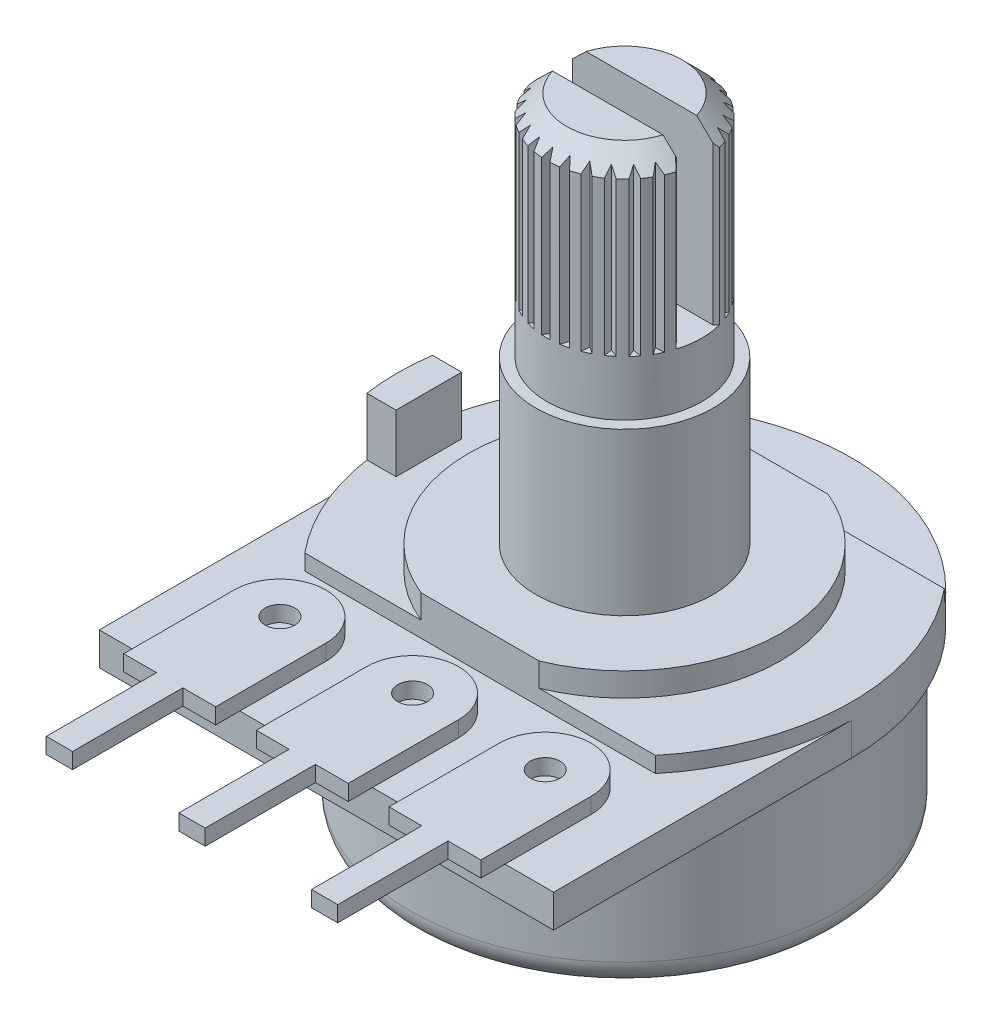
from build123d import *
from build123d.topology import SkipClean

# Parameters (mm, degrees)
CROQUIS1_R                = 8.15
SALIENTE_EXTRUIR1_DEPTH   = 6.3
REDONDEO1_R               = 1
SALIENTE_EXTRUIR2_DEPTH   = 1.25
CROQUIS11_W               = 3.9913563
CROQUIS11_H               = 2
CORTAR_EXTRUIR3_DEPTH     = 2.6
CROQUIS3_R                = 0.565497453
SALIENTE_EXTRUIR3_DEPTH   = 0.6
SALIENTE_EXTRUIR3_2_DEPTH = 0.6
SALIENTE_EXTRUIR3_3_DEPTH = 0.6
SALIENTE_EXTRUIR4_DEPTH   = 0.6
SALIENTE_EXTRUIR5_DEPTH   = 0.9
CROQUIS6_R                = 3.375
SALIENTE_EXTRUIR6_DEPTH   = 6.15
CROQUIS7_R                = 2.95
SALIENTE_EXTRUIR7_DEPTH   = 8.7
CHAFL_N1_SIZE             = 0.75
CROQUIS8_W                = 13.62856302
CROQUIS8_H                = 1.28
CORTAR_EXTRUIR1_DEPTH     = 6.6
CORTAR_EXTRUIR2_DEPTH     = 6.6
SALIENTE_EXTRUIR8_DEPTH   = 2.2


with BuildPart() as part:
    # Croquis1 → Saliente-Extruir1 (new body)
    with BuildSketch(Plane(origin=(0, 0, 0), x_dir=(1, 0, 0), z_dir=(0, 1, 0))):
        with Locations(Location((0, 0, 0), (0, 0, 270))):
            Circle(CROQUIS1_R)
    extrude(amount=SALIENTE_EXTRUIR1_DEPTH)

    # Redondeo1
    redondeo1_edges = [part.edges().sort_by_distance(p)[0] for p in [
        (0, 0, -8.15),
    ]]
    fillet(redondeo1_edges, radius=REDONDEO1_R)

    # Croquis2 → Saliente-Extruir2 (add)
    with BuildSketch(Plane(origin=(0, 6.3, 0), x_dir=(1, 0, 0), z_dir=(0, 1, 0))):
        with BuildLine():
            Line((-8.65, 0), (-8.65, -11.35))
            Line((-8.65, -11.35), (8.65, -11.35))
            Line((8.65, -11.35), (8.65, 0))
            ThreePointArc((8.65, 0), (0, 8.65), (-8.65, 0))
        make_face()
    extrude(amount=SALIENTE_EXTRUIR2_DEPTH)

    # Croquis11 → Cortar-Extruir3 (cut)
    with BuildSketch(Plane.XZ):
        with Locations((-8.65, 0)):
            Rectangle(CROQUIS11_W, CROQUIS11_H)
    extrude(amount=-CORTAR_EXTRUIR3_DEPTH, mode=Mode.SUBTRACT)

    # Croquis4 → Saliente-Extruir4 (add)
    with BuildSketch(Plane(origin=(0, 7.55, 0), x_dir=(1, 0, 0), z_dir=(0, 1, 0))):
        with BuildLine():
            Line((-6.676263925, -5.5), (6.676263925, -5.5))
            ThreePointArc((6.676263925, -5.5), (8.65, 0), (6.676263925, 5.5))
            Line((6.676263925, 5.5), (-6.676263925, 5.5))
            ThreePointArc((-6.676263925, 5.5), (-8.65, 0), (-6.676263925, -5.5))
        make_face()
    extrude(amount=SALIENTE_EXTRUIR4_DEPTH)

    # Croquis5 → Saliente-Extruir5 (add)
    with BuildSketch(Plane(origin=(0, 8.15, 0), x_dir=(1, 0, 0), z_dir=(0, 1, 0))):
        with BuildLine():
            Line((-2.25, 5.5), (2.25, 5.5))
            ThreePointArc((2.25, 5.5), (5.942432162, 0), (2.25, -5.5))
            Line((2.25, -5.5), (-2.25, -5.5))
            ThreePointArc((-2.25, -5.5), (-5.942432162, 0), (-2.25, 5.5))
        make_face()
    extrude(amount=SALIENTE_EXTRUIR5_DEPTH)

    # Croquis6 → Saliente-Extruir6 (add)
    with BuildSketch(Plane(origin=(0, 9.05, 0), x_dir=(1, 0, 0), z_dir=(0, 1, 0))):
        with Locations(Location((0, 0, 0), (0, 0, 270))):
            Circle(CROQUIS6_R)
    extrude(amount=SALIENTE_EXTRUIR6_DEPTH)

    # Croquis7 → Saliente-Extruir7 (add)
    with BuildSketch(Plane(origin=(0, 15.2, 0), x_dir=(1, 0, 0), z_dir=(0, 1, 0))):
        with Locations(Location((0, 0, 0), (0, 0, 270))):
            Circle(CROQUIS7_R)
    extrude(amount=SALIENTE_EXTRUIR7_DEPTH)

    # Chaflán1
    chafl_n1_edges = [part.edges().sort_by_distance(p)[0] for p in [
        (0, 23.9, -2.95),
    ]]
    chamfer(chafl_n1_edges, length=CHAFL_N1_SIZE)

    # Croquis8 → Cortar-Extruir1 (cut)
    with BuildSketch(Plane(origin=(0, 23.9, 0), x_dir=(1, 0, 0), z_dir=(0, 1, 0))):
        Rectangle(CROQUIS8_W, CROQUIS8_H)
    extrude(amount=-CORTAR_EXTRUIR1_DEPTH, mode=Mode.SUBTRACT)

    # Croquis9 → Cortar-Extruir2 (cut)
    with BuildSketch(Plane(origin=(0, 23.9, 0), x_dir=(1, 0, 0), z_dir=(0, 1, 0))):
        Polygon((0.05460617, 2.669961994), (0.313994159, 3.11923517), (-0.204781819, 3.11923517), align=None)
        Polygon((0.647359516, 2.590869457), (1.000216793, 2.971159158), (0.494447612, 3.086597673), align=None)
        Polygon((1.207651553, 2.381859906), (1.63628438, 2.67409682), (1.168883375, 2.899185281), align=None)
        Polygon((1.707386898, 2.053413954), (2.190301837, 2.242944101), (1.784706445, 2.566395633), align=None)
        Polygon((2.121506734, 1.622001252), (2.634488413, 1.699320799), (2.311036881, 2.104916191), align=None)
        Polygon((2.429245365, 1.109254634), (2.946570739, 1.070486457), (2.721482279, 1.537887462), align=None)
        Polygon((2.615171489, 0.540885357), (3.110899705, 0.387973454), (2.99546119, 0.893742634), align=None)
        Polygon((2.669961995, -0.05460617), (3.11923517, -0.313994159), (3.11923517, 0.204781819), align=None)
        Polygon((2.590869457, -0.647359516), (2.971159158, -1.000216793), (3.086597673, -0.494447612), align=None)
        Polygon((2.381859906, -1.207651553), (2.67409682, -1.63628438), (2.899185281, -1.168883375), align=None)
        Polygon((2.053413954, -1.707386898), (2.242944101, -2.190301837), (2.566395633, -1.784706445), align=None)
        Polygon((1.622001252, -2.121506734), (1.699320799, -2.634488413), (2.104916191, -2.311036881), align=None)
        Polygon((1.109254634, -2.429245365), (1.070486457, -2.946570739), (1.537887462, -2.721482278), align=None)
        Polygon((0.540885357, -2.615171489), (0.387973454, -3.110899705), (0.893742634, -2.99546119), align=None)
        Polygon((-0.05460617, -2.669961994), (-0.313994159, -3.11923517), (0.204781819, -3.11923517), align=None)
        Polygon((-0.647359516, -2.590869457), (-1.000216793, -2.971159158), (-0.494447612, -3.086597673), align=None)
        Polygon((-1.207651553, -2.381859906), (-1.63628438, -2.67409682), (-1.168883375, -2.899185281), align=None)
        Polygon((-1.707386898, -2.053413954), (-2.190301837, -2.242944101), (-1.784706445, -2.566395633), align=None)
        Polygon((-2.121506734, -1.622001252), (-2.634488413, -1.699320799), (-2.311036881, -2.104916191), align=None)
        Polygon((-2.429245365, -1.109254634), (-2.946570739, -1.070486457), (-2.721482278, -1.537887462), align=None)
        Polygon((-2.615171489, -0.540885357), (-3.110899705, -0.387973454), (-2.99546119, -0.893742634), align=None)
        Polygon((-2.669961994, 0.05460617), (-3.11923517, 0.313994159), (-3.11923517, -0.204781819), align=None)
        Polygon((-2.590869457, 0.647359516), (-2.971159158, 1.000216793), (-3.086597673, 0.494447612), align=None)
        Polygon((-2.381859906, 1.207651553), (-2.67409682, 1.63628438), (-2.899185281, 1.168883375), align=None)
        Polygon((-2.053413954, 1.707386898), (-2.242944101, 2.190301837), (-2.566395633, 1.784706445), align=None)
        Polygon((-1.622001252, 2.121506734), (-1.699320799, 2.634488413), (-2.104916191, 2.311036881), align=None)
        Polygon((-1.109254634, 2.429245365), (-1.070486457, 2.946570739), (-1.537887462, 2.721482278), align=None)
        Polygon((-0.540885357, 2.615171489), (-0.387973454, 3.110899705), (-0.893742634, 2.99546119), align=None)
    extrude(amount=-CORTAR_EXTRUIR2_DEPTH, mode=Mode.SUBTRACT)

    # Croquis10 → Saliente-Extruir8 (add)
    with SkipClean():  # the faces are left unmerged after this step: merging them gives an invalid solid
        with BuildSketch(Plane(origin=(0, 8.15, 0), x_dir=(1, 0, 0), z_dir=(0, 1, 0))):
            with BuildLine():
                Line((-8.559205571, 1.25), (-7.45, 1.25))
                Line((-7.45, 1.25), (-7.45, -1.25))
                Line((-7.45, -1.25), (-8.559205571, -1.25))
                ThreePointArc((-8.559205571, -1.25), (-8.65, 0), (-8.559205571, 1.25))
            make_face()
        extrude(amount=SALIENTE_EXTRUIR8_DEPTH)


with BuildPart() as body_2:
    # Croquis3 → Saliente-Extruir3 (new body)
    with BuildSketch(Plane(origin=(0, 7.55, 0), x_dir=(1, 0, 0), z_dir=(0, 1, 0))):
        with BuildLine():
            Line((-5.550000071, -16.47), (-5.549999929, -12.27))
            Line((-5.549999929, -12.27), (-6.8, -12.27))
            Line((-6.8, -12.27), (-6.8, -8.07))
            ThreePointArc((-6.8, -8.07), (-5.05, -6.32), (-3.3, -8.07))
            Line((-3.3, -8.07), (-3.3, -12.27))
            Line((-3.3, -12.27), (-4.550000071, -12.27))
            Line((-4.550000071, -12.27), (-4.550000071, -16.47))
            Line((-4.550000071, -16.47), (-5.550000071, -16.47))
        make_face()
        with Locations(Location((-5.05, -8.07, 0), (0, 0, 270))):
            Circle(CROQUIS3_R, mode=Mode.SUBTRACT)
    extrude(amount=SALIENTE_EXTRUIR3_DEPTH)


with BuildPart() as body_3:
    # Croquis3 → Saliente-Extruir3 2 (new body)
    with BuildSketch(Plane(origin=(0, 7.55, 0), x_dir=(1, 0, 0), z_dir=(0, 1, 0))):
        with BuildLine():
            Line((-0.500000071, -16.47), (-0.499999929, -12.27))
            Line((-0.499999929, -12.27), (-1.75, -12.27))
            Line((-1.75, -12.27), (-1.75, -8.07))
            ThreePointArc((-1.75, -8.07), (0, -6.32), (1.75, -8.07))
            Line((1.75, -8.07), (1.75, -12.27))
            Line((1.75, -12.27), (0.499999929, -12.27))
            Line((0.499999929, -12.27), (0.499999929, -16.47))
            Line((0.499999929, -16.47), (-0.500000071, -16.47))
        make_face()
        with Locations(Location((0, -8.07, 0), (0, 0, 270))):
            Circle(CROQUIS3_R, mode=Mode.SUBTRACT)
    extrude(amount=SALIENTE_EXTRUIR3_2_DEPTH)


with BuildPart() as body_4:
    # Croquis3 → Saliente-Extruir3 3 (new body)
    with BuildSketch(Plane(origin=(0, 7.55, 0), x_dir=(1, 0, 0), z_dir=(0, 1, 0))):
        with BuildLine():
            Line((4.549999929, -16.47), (4.550000071, -12.27))
            Line((4.550000071, -12.27), (3.3, -12.27))
            Line((3.3, -12.27), (3.3, -8.07))
            ThreePointArc((3.3, -8.07), (5.05, -6.32), (6.8, -8.07))
            Line((6.8, -8.07), (6.8, -12.27))
            Line((6.8, -12.27), (5.549999929, -12.27))
            Line((5.549999929, -12.27), (5.549999929, -16.47))
            Line((5.549999929, -16.47), (4.549999929, -16.47))
        make_face()
        with Locations(Location((5.05, -8.07, 0), (0, 0, 270))):
            Circle(CROQUIS3_R, mode=Mode.SUBTRACT)
    extrude(amount=SALIENTE_EXTRUIR3_3_DEPTH)


solid = Compound([part.part, body_2.part, body_3.part, body_4.part])
